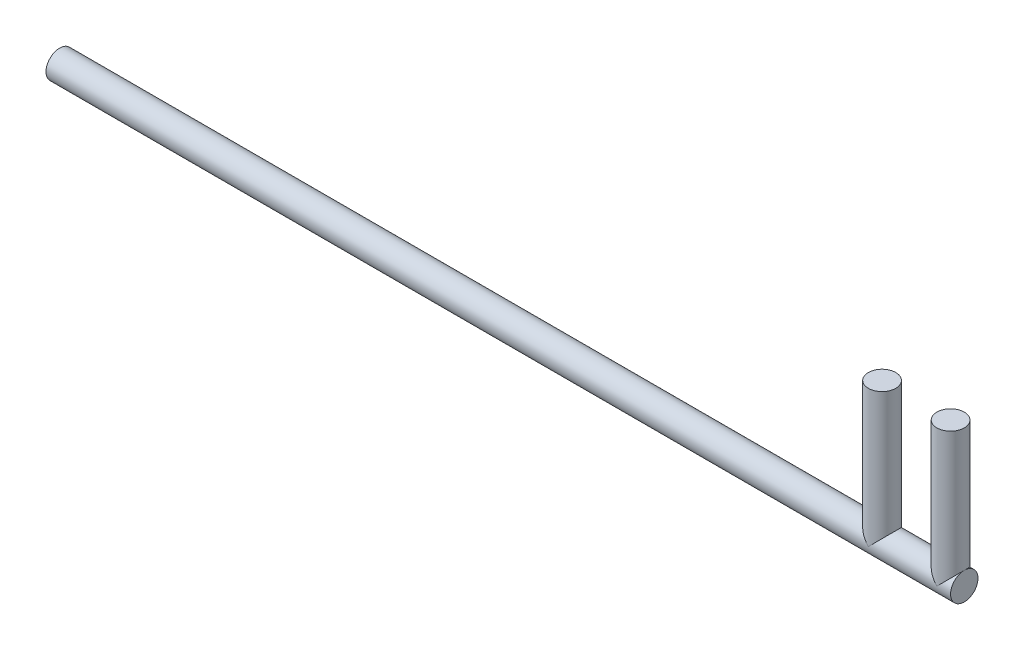
from build123d import *

# Parameters (mm, degrees)
VARREDURA1_PROFILE_R = 0.5
VARREDURA2_PROFILE_R = 0.5


with BuildPart() as part:
    # Varredura1: sweep along a path in Esboço1
    with BuildLine(Plane.XY) as varredura1_path:
        Line((8.34072569, 5), (8.34072569, 0))
        Line((8.34072569, 0), (5.84072569, 0))
        Line((5.84072569, 0), (5.84072569, 5))
    # Varredura1 profile (on start of the path) → Varredura1 (sweep)
    with BuildSketch(Plane(origin=(8.34072569, 5, 0), x_dir=(0, 0, -1), z_dir=(0, -1, 0))):
        Circle(VARREDURA1_PROFILE_R)
    sweep(path=varredura1_path.line, transition=Transition.RIGHT)

    # Varredura2: sweep along a path in Esboço37
    with BuildLine(Plane.XY) as varredura2_path:
        Line((8.84072569, 0), (-24.15927431, 0))
    # Varredura2 profile (on start of the path) → Varredura2 (sweep)
    with BuildSketch(Plane(origin=(8.84072569, 0, 0), x_dir=(0, -1, 0), z_dir=(-1, 0, 0))):
        Circle(VARREDURA2_PROFILE_R)
    sweep(path=varredura2_path.line)


solid = part.part
